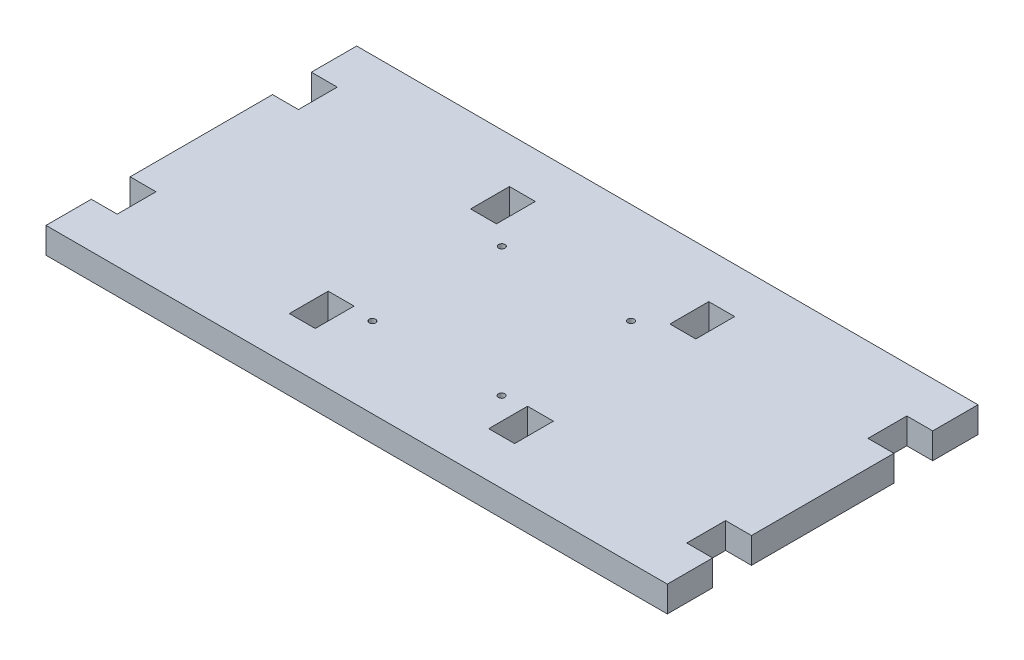
from build123d import *

# Parameters (mm, degrees)
SKETCH1_W          = 304.8
SKETCH1_H          = 152.4
EXTRUDE1_DEPTH     = 12.7
SKETCH2_W          = 12.7
SKETCH2_H          = 19.05
EXTRUDE2_DEPTH     = 171.861025398
SKETCH3_R          = 1.5875
CUT_EXTRUDE1_DEPTH = 171.861025398


with BuildPart() as part:
    # Sketch1 → Extrude1 (new body)
    with BuildSketch(Plane(origin=(0, 0, 0), x_dir=(1, 0, 0), z_dir=(0, 1, 0))):
        Rectangle(SKETCH1_W, SKETCH1_H)
    extrude(amount=EXTRUDE1_DEPTH)

    # Sketch2 → Extrude2 (cut, through all)
    with BuildSketch(Plane(origin=(0, 12.7, 0), x_dir=(1, 0, 0), z_dir=(0, 1, 0))):
        with Locations((-48.895, 44.45)):
            Rectangle(SKETCH2_W, SKETCH2_H)
        with Locations((48.895, 44.45)):
            Rectangle(SKETCH2_W, SKETCH2_H)
        with Locations((-48.895, -44.45)):
            Rectangle(SKETCH2_W, SKETCH2_H)
        with Locations((48.895, -44.45)):
            Rectangle(SKETCH2_W, SKETCH2_H)
        with Locations((146.05, 44.45)):
            Rectangle(SKETCH2_W, SKETCH2_H)
        with Locations((-146.05, 44.45)):
            Rectangle(SKETCH2_W, SKETCH2_H)
        with Locations((146.05, -44.45)):
            Rectangle(SKETCH2_W, SKETCH2_H)
        with Locations((-146.05, -44.45)):
            Rectangle(SKETCH2_W, SKETCH2_H)
    extrude(amount=-EXTRUDE2_DEPTH, mode=Mode.SUBTRACT)

    # Sketch3 → Cut-Extrude1 (cut, through all)
    with BuildSketch(Plane.XZ):
        with Locations(Location((31.6865, 36.796180661, 0), (0, 0, 270))):
            Circle(SKETCH3_R)
        with Locations(Location((31.6865, -26.703819339, 0), (0, 0, 270))):
            Circle(SKETCH3_R)
        with Locations(Location((-31.6865, -26.703819339, 0), (0, 0, 90))):
            Circle(SKETCH3_R)
        with Locations(Location((-31.6865, 36.796180661, 0), (0, 0, 90))):
            Circle(SKETCH3_R)
    extrude(amount=-CUT_EXTRUDE1_DEPTH, mode=Mode.SUBTRACT)


solid = part.part
